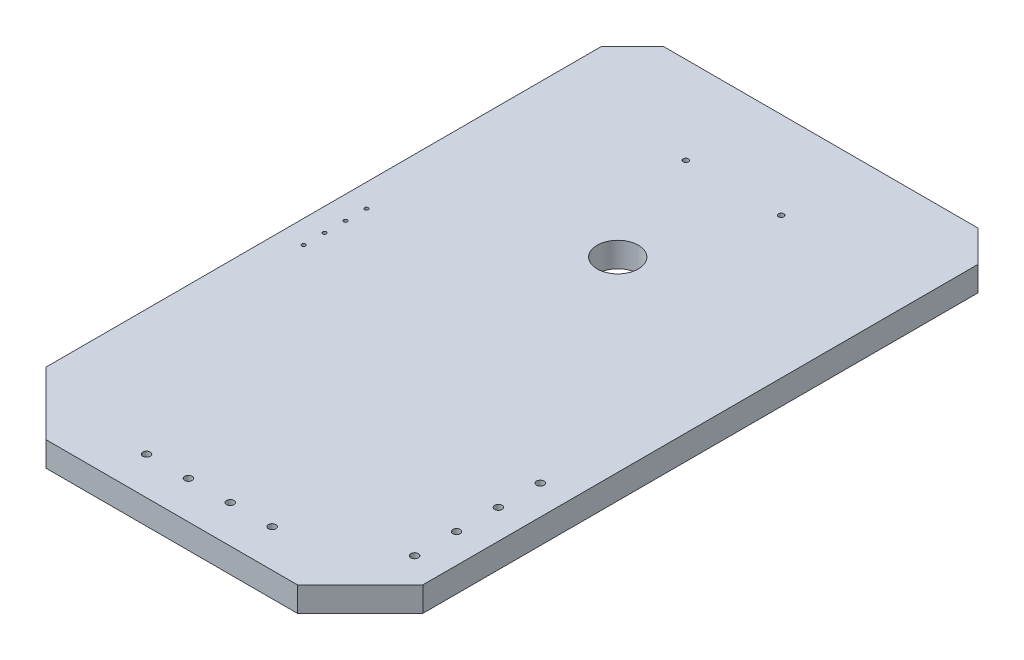
from build123d import *

# Parameters (mm, degrees)
SKETCH_1_R          = 0.1625092
SKETCH_1_R_2        = 0.2249932
SKETCH_1_R_3        = 0.1124966
EXTRUDE_1_DEPTH     = 1.5
SKETCH_2_R          = 1.25
CUT_EXTRUDE_1_DEPTH = 171.139217701


with BuildPart() as part:
    # 草图1 → 凸台-拉伸1 (new body)
    with BuildSketch(Plane(origin=(0, 0, 0), x_dir=(1, 0, 0), z_dir=(0, 1, 0))):
        Polygon((139.065, 95.25), (120.015, 95.25), (118.11, 93.345), (118.11, 59.69), (121.92, 55.88), (137.16, 55.88), (140.97, 59.69), (140.97, 93.345), align=None)
        with Locations(Location((126.65202, 89.94902, 0), (0, 0, 270))):
            Circle(SKETCH_1_R, mode=Mode.SUBTRACT)
        with Locations(Location((132.42798, 89.94902, 0), (0, 0, 270))):
            Circle(SKETCH_1_R, mode=Mode.SUBTRACT)
        with Locations(Location((133.35, 58.166, 0), (0, 0, 270))):
            Circle(SKETCH_1_R_2, mode=Mode.SUBTRACT)
        with Locations(Location((130.81, 58.166, 0), (0, 0, 270))):
            Circle(SKETCH_1_R_2, mode=Mode.SUBTRACT)
        with Locations(Location((128.27, 58.166, 0), (0, 0, 270))):
            Circle(SKETCH_1_R_2, mode=Mode.SUBTRACT)
        with Locations(Location((125.73, 58.166, 0), (0, 0, 270))):
            Circle(SKETCH_1_R_2, mode=Mode.SUBTRACT)
        with Locations(Location((139.192, 68.58, 0), (0, 0, 270))):
            Circle(SKETCH_1_R_2, mode=Mode.SUBTRACT)
        with Locations(Location((139.192, 66.04, 0), (0, 0, 270))):
            Circle(SKETCH_1_R_2, mode=Mode.SUBTRACT)
        with Locations(Location((139.192, 63.5, 0), (0, 0, 270))):
            Circle(SKETCH_1_R_2, mode=Mode.SUBTRACT)
        with Locations(Location((139.192, 60.96, 0), (0, 0, 270))):
            Circle(SKETCH_1_R_2, mode=Mode.SUBTRACT)
        with Locations(Location((119.507, 77.724, 0), (0, 0, 270))):
            Circle(SKETCH_1_R_3, mode=Mode.SUBTRACT)
        with Locations(Location((119.507, 76.454, 0), (0, 0, 270))):
            Circle(SKETCH_1_R_3, mode=Mode.SUBTRACT)
        with Locations(Location((119.507, 73.914, 0), (0, 0, 270))):
            Circle(SKETCH_1_R_3, mode=Mode.SUBTRACT)
        with Locations(Location((119.507, 75.184, 0), (0, 0, 270))):
            Circle(SKETCH_1_R_3, mode=Mode.SUBTRACT)
    extrude(amount=EXTRUDE_1_DEPTH)

    # 草图2 → 切除-拉伸1 (cut, through all)
    with BuildSketch(Plane(origin=(0, 1.5, 0), x_dir=(1, 0, 0), z_dir=(0, 1, 0))):
        with Locations(Location((129.667, 82.804, 0), (0, 0, 270))):
            Circle(SKETCH_2_R)
    extrude(amount=-CUT_EXTRUDE_1_DEPTH, mode=Mode.SUBTRACT)


solid = part.part
